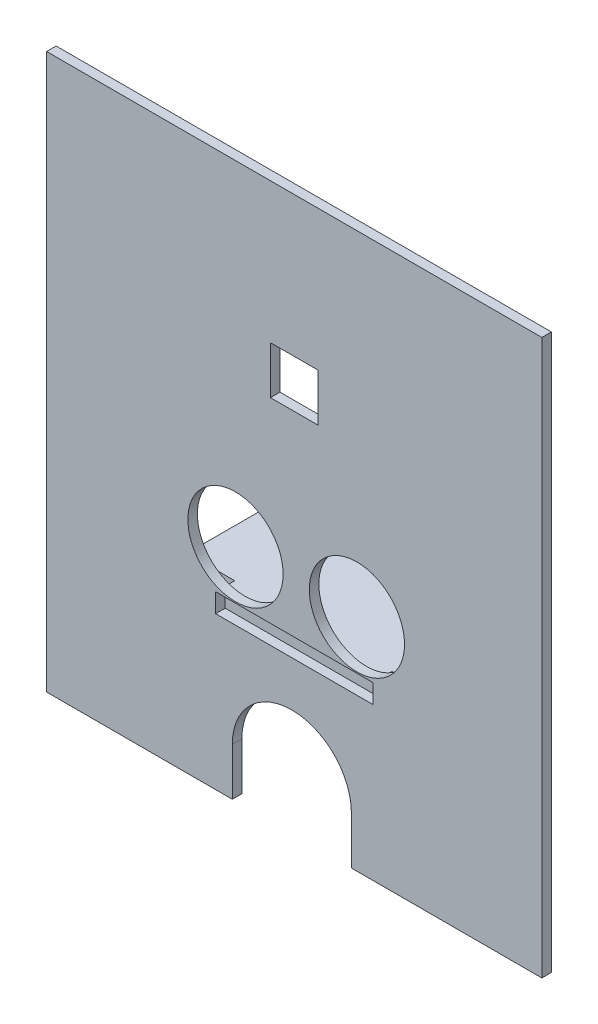
from build123d import *

# Parameters (mm, degrees)
SKETCH_1_W          = 104
SKETCH_1_H          = 116.5
EXTRUDE_1_DEPTH     = 2
CUT_EXTRUDE_1_DEPTH = 4
SKETCH_5_W          = 53
SKETCH_5_H          = 4
EXTRUDE_2_DEPTH     = 20
SKETCH_6_W          = 10
SKETCH_6_H          = 2
CUT_EXTRUDE_2_DEPTH = 20
SKETCH_8_W          = 33
SKETCH_8_H          = 4
CUT_EXTRUDE_3_DEPTH = 2
SKETCH_9_R          = 10
CUT_EXTRUDE_4_DEPTH = 2
SKETCH_10_W         = 8.5
SKETCH_10_H         = 8.5
SKETCH_10_W_2       = 0.75
SKETCH_10_H_2       = 0.75
CUT_EXTRUDE_5_DEPTH = 2


with BuildPart() as part:
    # 스케치1 → 보스-돌출1 (new body)
    with BuildSketch(Plane.XY):
        with Locations((0, 63.25)):
            Rectangle(SKETCH_1_W, SKETCH_1_H)
    extrude(amount=EXTRUDE_1_DEPTH)

    # 스케치3 → 컷-돌출1 (cut)
    with BuildSketch(Plane.XY.offset(2)):
        with BuildLine():
            Line((-13, 15), (-13, 5))
            Line((-13, 5), (12, 5))
            Line((12, 5), (12, 15))
            ThreePointArc((12, 15), (-0.5, 27.5), (-13, 15))
        make_face()
    extrude(amount=-CUT_EXTRUDE_1_DEPTH, mode=Mode.SUBTRACT)

    # 스케치8 → 컷-돌출3 (cut)
    with BuildSketch(Plane.XY.offset(2)):
        with Locations((0.001833015, 39)):
            Rectangle(SKETCH_8_W, SKETCH_8_H)
    extrude(amount=-CUT_EXTRUDE_3_DEPTH, mode=Mode.SUBTRACT)

    # 스케치9 → 컷-돌출4 (cut)
    with BuildSketch(Plane.XY.offset(2)):
        with Locations((-12.34, 51.25)):
            Circle(SKETCH_9_R)
        with Locations((13.16, 51.25)):
            Circle(SKETCH_9_R)
    extrude(amount=-CUT_EXTRUDE_4_DEPTH, mode=Mode.SUBTRACT)

    # 스케치10 → 컷-돌출5 (cut)
    # profile 1 of 3: a face of its own
    with BuildSketch(Plane(origin=(0, 0, 0), x_dir=(-1, 0, 0), z_dir=(0, 0, -1))):
        Polygon((4.25, 91.3), (4.25, 92.05), (-5, 92.05), (-5, 82.05), (5, 82.05), (5, 91.3), align=None)
        with Locations((0, 87.05)):
            Rectangle(SKETCH_10_W, SKETCH_10_H, mode=Mode.SUBTRACT)
    # profile 2 of 3: a face of its own
    with BuildSketch(Plane(origin=(0, 0, 0), x_dir=(-1, 0, 0), z_dir=(0, 0, -1))):
        with Locations((0, 87.05)):
            Rectangle(SKETCH_10_W, SKETCH_10_H)
    # profile 3 of 3: a face of its own
    with BuildSketch(Plane(origin=(0, 0, 0), x_dir=(-1, 0, 0), z_dir=(0, 0, -1))):
        with Locations((4.625, 91.675)):
            Rectangle(SKETCH_10_W_2, SKETCH_10_H_2)
    extrude(amount=-CUT_EXTRUDE_5_DEPTH, mode=Mode.SUBTRACT)


with BuildPart() as body_2:
    # 스케치5 → 보스-돌출2 (new body)
    with BuildSketch(Plane(origin=(0, 0, 0), x_dir=(-1, 0, 0), z_dir=(0, 0, -1))):
        with Locations((0, 39)):
            Rectangle(SKETCH_5_W, SKETCH_5_H)
    extrude(amount=EXTRUDE_2_DEPTH)

    # 스케치6 → 컷-돌출2 (cut)
    with BuildSketch(Plane(origin=(0, 41, 0), x_dir=(1, 0, 0), z_dir=(0, 1, 0))):
        with Locations((21.5, 1)):
            Rectangle(SKETCH_6_W, SKETCH_6_H)
        with Locations((-21.5, 1)):
            Rectangle(SKETCH_6_W, SKETCH_6_H)
    extrude(amount=-CUT_EXTRUDE_2_DEPTH, mode=Mode.SUBTRACT)


solid = Compound([part.part, body_2.part])
